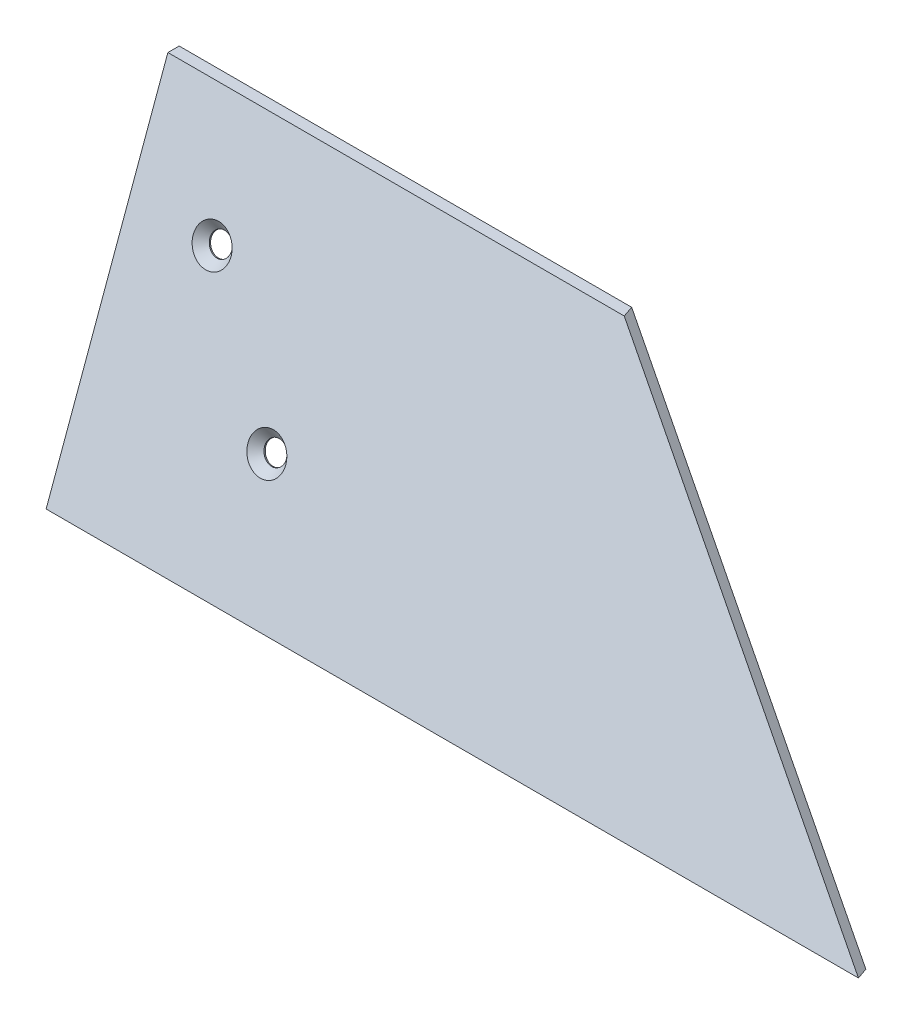
from build123d import *

# Parameters (mm, degrees)
MAIN_DEPTH                   = 85
BACKBRACKETHOLES_D           = 4.572
BACKBRACKETHOLES_DEPTH       = 5
BACKBRACKETHOLES_CSINK_D     = 7.9248
BACKBRACKETHOLES_CSINK_ANGLE = 82
FRONT_CUT_REACH              = 115.044


with BuildPart() as part:
    # Sketch1 → Main (new, symmetric)
    with BuildSketch(Plane(origin=(0, 0, 0), x_dir=(0, 0, -1), z_dir=(1, 0, 0))):
        Polygon((0, 0), (-2.3622, 0), (23.115716399, 70), (25.477916399, 70), align=None)
    extrude(amount=MAIN_DEPTH, both=True)

    # BackBracketHoles
    with Locations(Plane(origin=(0, 0.759196446, 2.085875092), x_dir=(1, 0, 0), z_dir=(0, 0.3420201433256726, 0.9396926207859071))):
        with Locations((-67.6378, 50.002080017), (-47.6378, 25.002080017)):
            CounterSinkHole(BACKBRACKETHOLES_D / 2, BACKBRACKETHOLES_CSINK_D / 2, depth=BACKBRACKETHOLES_DEPTH, counter_sink_angle=BACKBRACKETHOLES_CSINK_ANGLE)

    # Sketch4 → Front Cut (cut, up to next)
    with BuildSketch(Plane(origin=(0, 0.759196446, 2.085875092), x_dir=(1, 0, 0), z_dir=(0, 0.3420201433256726, 0.9396926207859071)), mode=Mode.PRIVATE) as front_cut_sk1:
        Polygon((85, -0.807919983), (9.699635944, 74.492444073), (85, 74.492444073), align=None)
    front_cut_tool1 = extrude(front_cut_sk1.sketch, amount=-FRONT_CUT_REACH, mode=Mode.PRIVATE) & part.part
    add(front_cut_tool1.solids().sort_by_distance((59.899879, 47.172798, -14.807294))[0], mode=Mode.SUBTRACT)


solid = part.part
